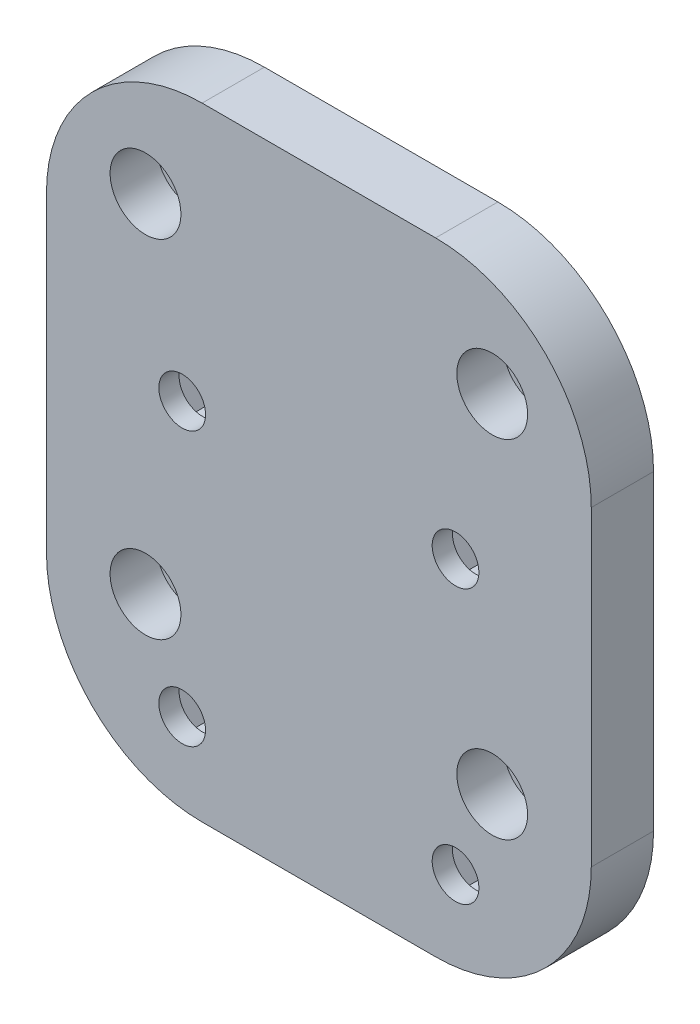
from build123d import *

# Parameters (mm, degrees)
SKETCH_1_W          = 70
SKETCH_1_H          = 80
EXTRUDE_1_DEPTH     = 8
SKETCH_11_R         = 3
CUT_EXTRUDE_4_DEPTH = 15
SKETCH_13_R         = 4.55
CUT_EXTRUDE_6_DEPTH = 6
SKETCH_14_R         = 3
CUT_EXTRUDE_7_DEPTH = 16
CUT_EXTRUDE_8_DEPTH = 5.4
FILLET_1_R          = 20


with BuildPart() as part:
    # 草图1 → 凸台-拉伸1 (new body)
    with BuildSketch(Plane.XY):
        Rectangle(SKETCH_1_W, SKETCH_1_H)
    extrude(amount=EXTRUDE_1_DEPTH)

    # 草图11 → 切除-拉伸4 (cut)
    with BuildSketch(Plane.XY):
        with Locations((-22.273863607, 26.273863607)):
            Circle(SKETCH_11_R)
        with Locations((22.273863607, 26.273863607)):
            Circle(SKETCH_11_R)
        with Locations((22.273863607, -18.273863607)):
            Circle(SKETCH_11_R)
        with Locations((-22.273863607, -18.273863607)):
            Circle(SKETCH_11_R)
    extrude(amount=CUT_EXTRUDE_4_DEPTH, mode=Mode.SUBTRACT)

    # 草图13 → 切除-拉伸6 (cut)
    with BuildSketch(Plane.XY.offset(8)):
        with Locations((-22.273863607, 26.273863607)):
            Circle(SKETCH_13_R)
        with Locations((-22.273863607, -18.273863607)):
            Circle(SKETCH_13_R)
        with Locations(Location((22.273863607, -18.273863607, 0), (0, 0, 180))):
            Circle(SKETCH_13_R)
        with Locations(Location((22.273863607, 26.273863607, 0), (0, 0, 180))):
            Circle(SKETCH_13_R)
    extrude(amount=-CUT_EXTRUDE_6_DEPTH, mode=Mode.SUBTRACT)

    # 草图14 → 切除-拉伸7 (cut)
    with BuildSketch(Plane.XY.offset(8)):
        with Locations((-17.56, 5.56)):
            Circle(SKETCH_14_R)
        with Locations((17.56, 5.56)):
            Circle(SKETCH_14_R)
        with Locations((17.56, -29.56)):
            Circle(SKETCH_14_R)
        with Locations((-17.56, -29.56)):
            Circle(SKETCH_14_R)
    extrude(amount=-CUT_EXTRUDE_7_DEPTH, mode=Mode.SUBTRACT)

    # 草图15 → 切除-拉伸8 (cut)
    with BuildSketch(Plane(origin=(0, 0, 0), x_dir=(-1, 0, 0), z_dir=(0, 0, -1))):
        Polygon((-14.713663173, 0.63), (-11.867326346, 5.56), (-14.713663173, 10.49), (-20.406336827, 10.49), (-23.252673654, 5.56), (-20.406336827, 0.63), align=None)
        Polygon((-14.713663173, -34.49), (-11.867326346, -29.56), (-14.713663173, -24.63), (-20.406336827, -24.63), (-23.252673654, -29.56), (-20.406336827, -34.49), align=None)
        Polygon((20.406336827, -34.49), (14.713663173, -34.49), (11.867326346, -29.56), (14.713663173, -24.63), (20.406336827, -24.63), (23.252673654, -29.56), align=None)
        Polygon((20.406336827, 0.63), (14.713663173, 0.63), (11.867326346, 5.56), (14.713663173, 10.49), (20.406336827, 10.49), (23.252673654, 5.56), align=None)
    extrude(amount=-CUT_EXTRUDE_8_DEPTH, mode=Mode.SUBTRACT)

    # 圆角1
    fillet_1_edges = [part.edges().sort_by_distance(p)[0] for p in [
        (-35, 40, 4),
        (35, 40, 4),
        (35, -40, 4),
        (-35, -40, 4),
    ]]
    fillet(fillet_1_edges, radius=FILLET_1_R)


solid = part.part
